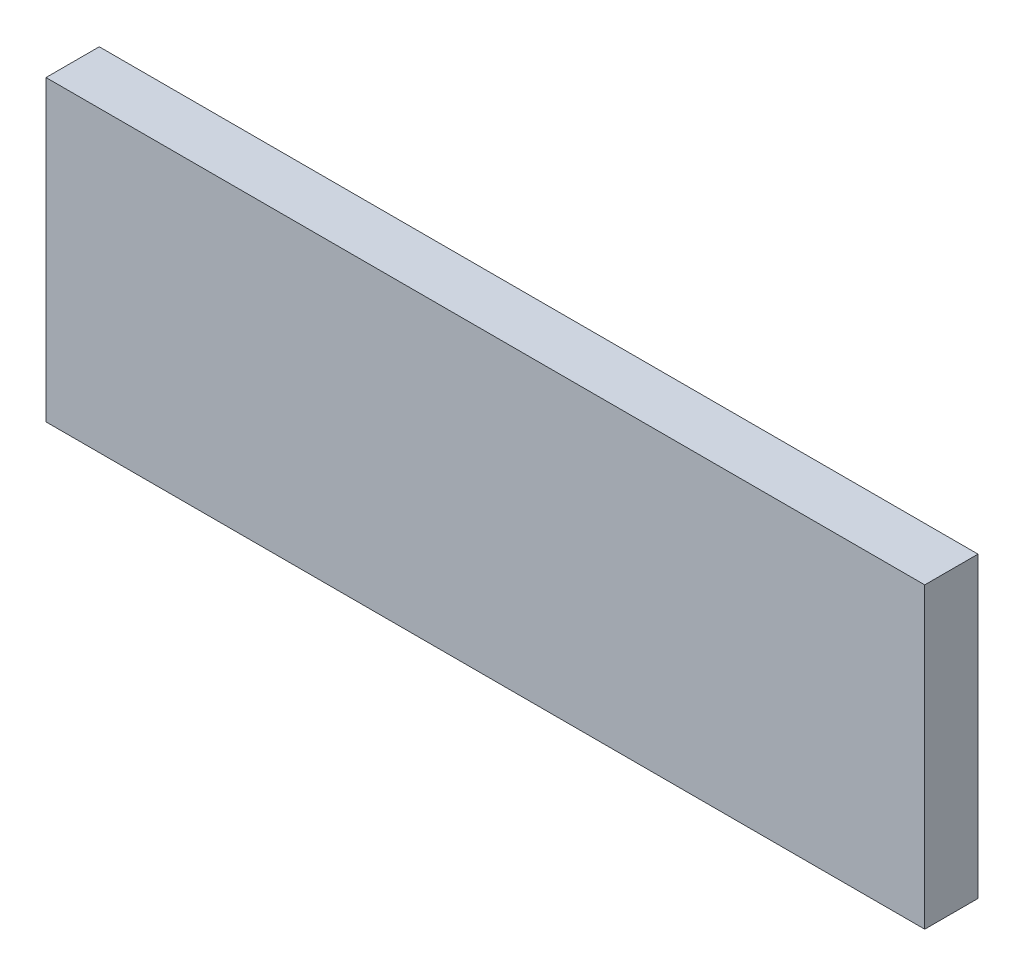
from build123d import *

# Parameters (mm, degrees)
SKETCH1_W           = 165
SKETCH1_H           = 56
BOSS_EXTRUDE2_DEPTH = 10


with BuildPart() as part:
    # Sketch1 → Boss-Extrude2 (new body)
    with BuildSketch(Plane.XY):
        Rectangle(SKETCH1_W, SKETCH1_H)
    extrude(amount=BOSS_EXTRUDE2_DEPTH)


solid = part.part
